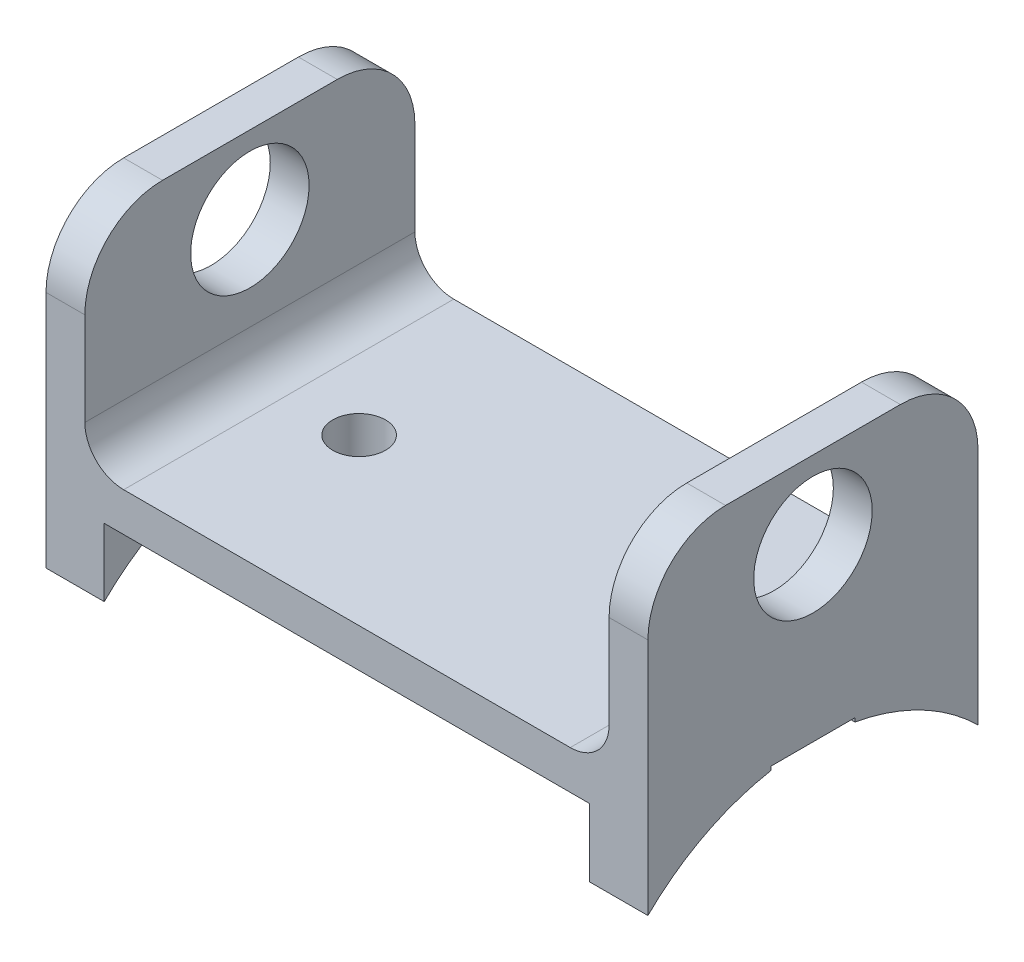
from build123d import *

# Parameters (mm, degrees)
SKETCH1_W            = 34.29
SKETCH1_H            = 21.59
SKETCH1_R            = 1.7272
BOSS_EXTRUDE1_DEPTH  = 2.54
SKETCH2_W            = 21.59
SKETCH2_H            = 16.256
SKETCH2_R            = 3.8735
BOSS_EXTRUDE2_DEPTH  = 2.54
FILLET1_R            = 5.08
BOSS_EXTRUDE5_DEPTH  = 3.81
MIRROR4_COPY_1_DEPTH = 3.81
FILLET3_R            = 2.54


with BuildPart() as part:
    # Sketch1 → Boss-Extrude1 (new body)
    with BuildSketch(Plane(origin=(0, 0, 0), x_dir=(1, 0, 0), z_dir=(0, 1, 0))):
        Rectangle(SKETCH1_W, SKETCH1_H)
        with Locations(Location((-10, 0, 0), (0, 0, 270))):
            Circle(SKETCH1_R, mode=Mode.SUBTRACT)
        with Locations(Location((10, 0, 0), (0, 0, 270))):
            Circle(SKETCH1_R, mode=Mode.SUBTRACT)
    extrude(amount=BOSS_EXTRUDE1_DEPTH)

    # Sketch2 → Boss-Extrude2 (add)
    with BuildSketch(Plane(origin=(17.145, 0, 0), x_dir=(0, 0, -1), z_dir=(1, 0, 0))):
        with Locations((0, 8.128)):
            Rectangle(SKETCH2_W, SKETCH2_H)
        with Locations((0, 11.176)):
            Circle(SKETCH2_R, mode=Mode.SUBTRACT)
    boss_extrude2 = extrude(amount=BOSS_EXTRUDE2_DEPTH)

    # Mirror1: Boss-Extrude2 across plane
    add(boss_extrude2.mirror(Plane(origin=(0, 0, 0), x_dir=(0, 0, 1), z_dir=(1, 0, 0))))

    # Fillet1
    fillet1_edges = [part.edges().sort_by_distance(p)[0] for p in [
        (-18.415, 16.256, -10.795),
        (-18.415, 16.256, 10.795),
        (18.415, 16.256, 10.795),
        (18.415, 16.256, -10.795),
    ]]
    fillet(fillet1_edges, radius=FILLET1_R)

    # Sketch11 → Boss-Extrude5 (add)
    with BuildSketch(Plane.ZY.offset(19.685)):
        with BuildLine():
            Line((-10.795, 0), (-10.795, -4.437141758))
            ThreePointArc((-10.795, -4.437141758), (-7.088953516, -1.734962797), (-2.75, -0.248344462))
            Line((-2.75, -0.248344462), (-2.75, 0))
            Line((-2.75, 0), (-10.795, 0))
        make_face()
    boss_extrude5 = extrude(amount=-BOSS_EXTRUDE5_DEPTH)

    # Mirror3: Boss-Extrude5 across plane
    add(boss_extrude5.mirror(Plane.XY))

    # Mirror4: Boss-Extrude5 across plane
    add(boss_extrude5.mirror(Plane(origin=(0, 0, 0), x_dir=(0, 0, 1), z_dir=(1, 0, 0))))

    # Mirror4 copy 1 sketch → Mirror4 copy 1 (add)
    with BuildSketch(Plane(origin=(19.685, 0, 0), x_dir=(0, 0, -1), z_dir=(1, 0, 0))):
        with BuildLine():
            Line((-10.795, 0), (-10.795, -4.437141758))
            ThreePointArc((-10.795, -4.437141758), (-7.088953516, -1.734962797), (-2.75, -0.248344462))
            Line((-2.75, -0.248344462), (-2.75, 0))
            Line((-2.75, 0), (-10.795, 0))
        make_face()
    extrude(amount=-MIRROR4_COPY_1_DEPTH)

    # Fillet3
    fillet3_edges = [part.edges().sort_by_distance(p)[0] for p in [
        (-17.145, 2.54, 0),
        (17.145, 2.54, 0),
    ]]
    fillet(fillet3_edges, radius=FILLET3_R)


solid = part.part
